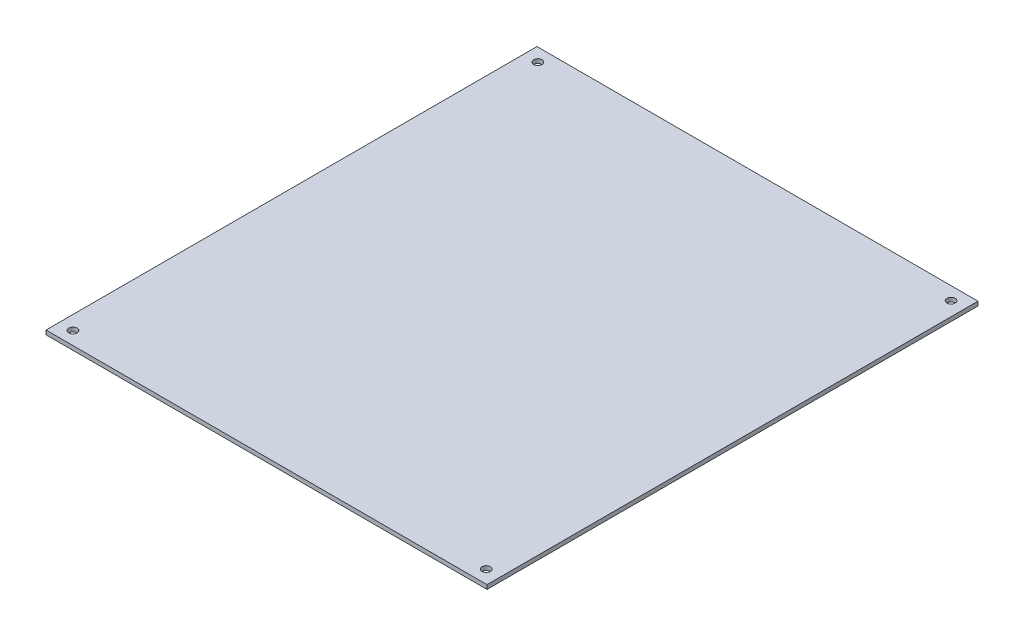
from build123d import *

# Parameters (mm, degrees)
SKETCH1_W           = 212
SKETCH1_H           = 236
BOSS_EXTRUDE1_DEPTH = 2
SKETCH2_R           = 2
CUT_EXTRUDE1_DEPTH  = 159.631648797


with BuildPart() as part:
    # Sketch1 → Boss-Extrude1 (new body)
    with BuildSketch(Plane(origin=(0, 0, 0), x_dir=(1, 0, 0), z_dir=(0, 1, 0))):
        Rectangle(SKETCH1_W, SKETCH1_H)
    extrude(amount=BOSS_EXTRUDE1_DEPTH)

    # Sketch2 → Cut-Extrude1 (cut, through all)
    with BuildSketch(Plane(origin=(0, 2, 0), x_dir=(1, 0, 0), z_dir=(0, 1, 0))):
        with Locations(Location((99.321819194, 111.737046593, 0), (0, 0, 270))):
            Circle(SKETCH2_R)
        with Locations(Location((-99.321819194, 111.737046593, 0), (0, 0, 270))):
            Circle(SKETCH2_R)
        with Locations(Location((-99.321819194, -111.737046593, 0), (0, 0, 270))):
            Circle(SKETCH2_R)
        with Locations(Location((99.321819194, -111.737046593, 0), (0, 0, 270))):
            Circle(SKETCH2_R)
    extrude(amount=-CUT_EXTRUDE1_DEPTH, mode=Mode.SUBTRACT)


solid = part.part
